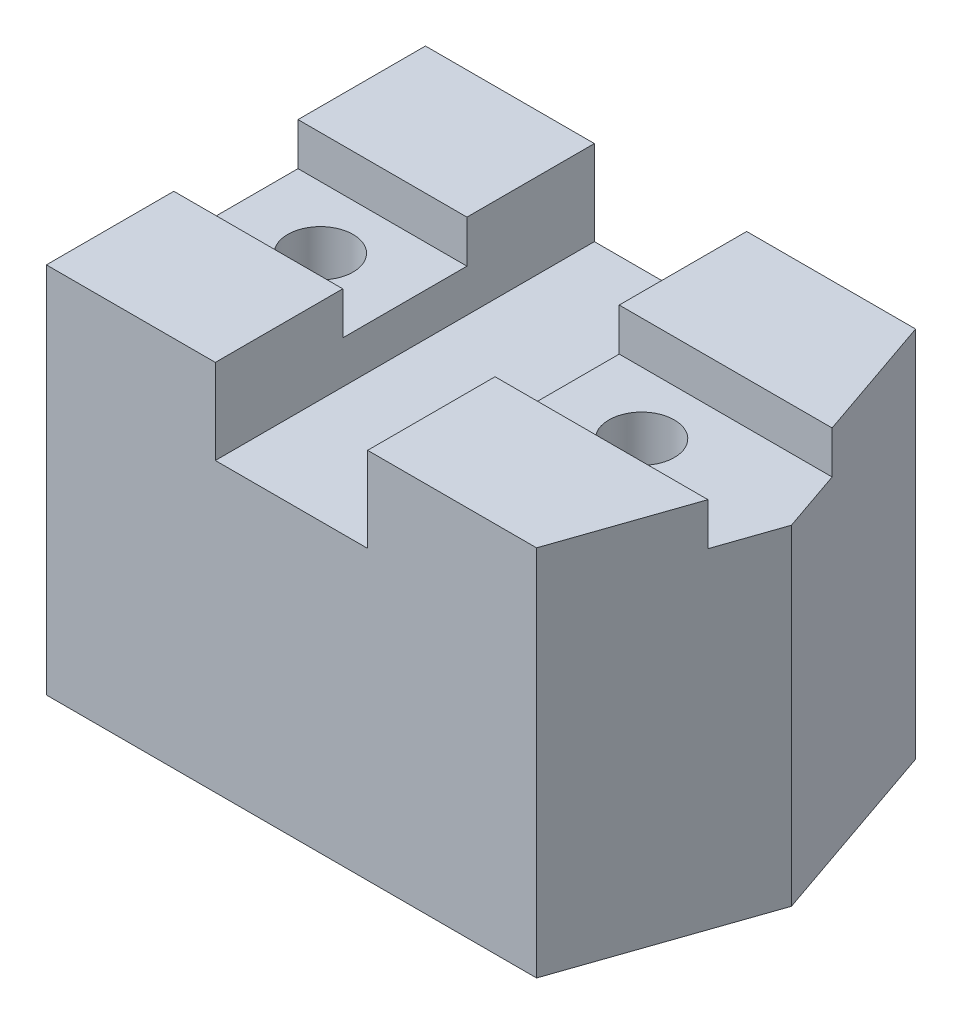
from build123d import *

# Parameters (mm, degrees)
ESTRUSIONE_ESTRUSIONE1_DEPTH = 114
TAGLIO_ESTRUSIONE3_DEPTH     = 13
SCHIZZO6_W                   = 46.601982298
SCHIZZO6_H                   = 116
TAGLIO_ESTRUSIONE4_DEPTH     = 26
SCHIZZO7_R                   = 10
TAGLIO_ESTRUSIONE5_DEPTH     = 159.263069137


with BuildPart() as part:
    # Schizzo1 → Estrusione-Estrusione1 (new body)
    with BuildSketch(Plane(origin=(0, 0, 0), x_dir=(1, 0, 0), z_dir=(0, 1, 0))):
        Polygon((-107.155023459, -58), (-107.155023459, 58), (42.844976541, 58), (62.844976541, 0), (42.844976541, -58), align=None)
    extrude(amount=ESTRUSIONE_ESTRUSIONE1_DEPTH)

    # Schizzo3 → Taglio-Estrusione3 (cut)
    with BuildSketch(Plane(origin=(0, 114, 0), x_dir=(1, 0, 0), z_dir=(0, 1, 0))):
        Polygon((-107.155023459, -19), (-107.155023459, 19), (56.293252403, 19), (62.844976541, 0), (56.293252403, -19), align=None)
    extrude(amount=-TAGLIO_ESTRUSIONE3_DEPTH, mode=Mode.SUBTRACT)

    # Schizzo6 → Taglio-Estrusione4 (cut)
    with BuildSketch(Plane(origin=(0, 114, 0), x_dir=(1, 0, 0), z_dir=(0, 1, 0))):
        with Locations((-32.155023459, 0)):
            Rectangle(SCHIZZO6_W, SCHIZZO6_H)
    extrude(amount=-TAGLIO_ESTRUSIONE4_DEPTH, mode=Mode.SUBTRACT)

    # Schizzo7 → Taglio-Estrusione5 (cut, through all)
    with BuildSketch(Plane(origin=(0, 101, 0), x_dir=(1, 0, 0), z_dir=(0, 1, 0))):
        with Locations(Location((-81.305519034, 0, 0), (0, 0, 270))):
            Circle(SCHIZZO7_R)
        with Locations(Location((16.995472115, 0, 0), (0, 0, 90))):
            Circle(SCHIZZO7_R)
    extrude(amount=-TAGLIO_ESTRUSIONE5_DEPTH, mode=Mode.SUBTRACT)


solid = part.part
